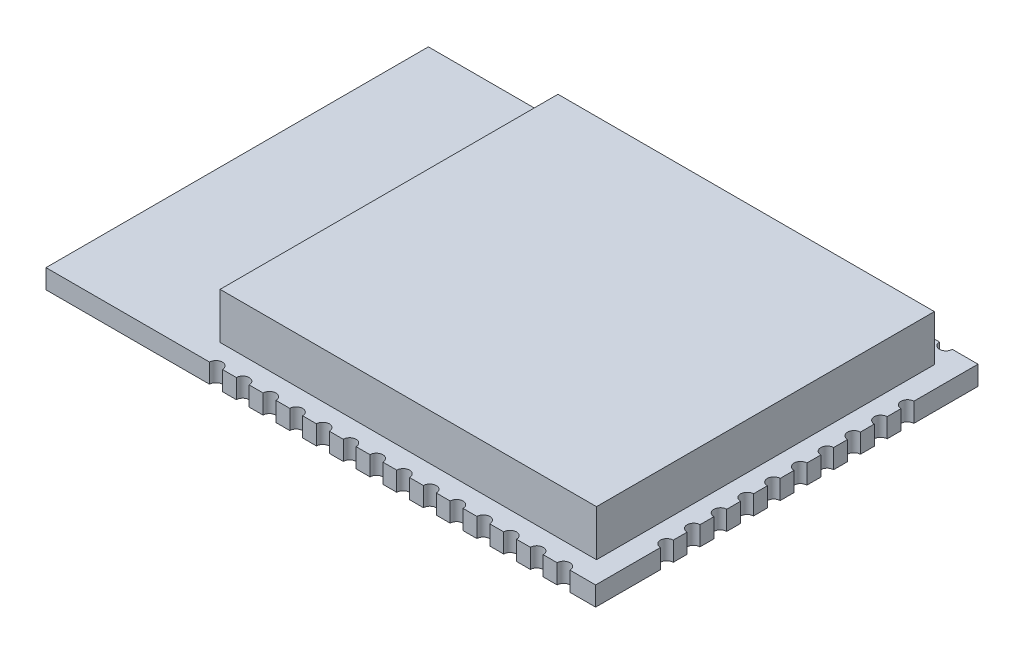
from build123d import *

# Parameters (mm, degrees)
SKETCH2_W             = 25.7
SKETCH2_H             = 17.88
BOSS_EXTRUDE1_DEPTH   = 0.9
SKETCH3_W             = 17.6
SKETCH3_H             = 15.8
BOSS_EXTRUDE2_DEPTH   = 2.15
F_1_5MM_DOWEL_HOLE1_D = 0.6


with BuildPart() as part:
    # Sketch2 → Boss-Extrude1 (new body)
    with BuildSketch(Plane(origin=(0, 0, 0), x_dir=(1, 0, 0), z_dir=(0, 1, 0))):
        Rectangle(SKETCH2_W, SKETCH2_H)
    extrude(amount=BOSS_EXTRUDE1_DEPTH)

    # Sketch3 → Boss-Extrude2 (add)
    with BuildSketch(Plane(origin=(0, 0.9, 0), x_dir=(1, 0, 0), z_dir=(0, 1, 0))):
        with Locations((3.05, 0)):
            Rectangle(SKETCH3_W, SKETCH3_H)
    extrude(amount=BOSS_EXTRUDE2_DEPTH)

    # Ø1.5mm Dowel Hole1 (through all)
    with Locations(Plane(origin=(0, 3.05, 0), x_dir=(1, 0, 0), z_dir=(0, 1, 0))):
        with Locations((11.35, 8.94), (10.1, 8.94), (8.85, 8.94), (7.6, 8.94), (6.35, 8.94), (5.1, 8.94), (3.85, 8.94), (2.6, 8.94), (1.35, 8.94), (0.1, 8.94), (-1.15, 8.94), (-2.4, 8.94), (-3.65, 8.94), (-4.9, 8.94), (11.35, -8.94), (10.1, -8.94), (8.85, -8.94), (7.6, -8.94), (6.35, -8.94), (5.1, -8.94), (3.85, -8.94), (2.6, -8.94), (1.35, -8.94), (0.1, -8.94), (-1.15, -8.94), (-2.4, -8.94), (-3.65, -8.94), (-4.9, -8.94), (12.85, 5.64), (12.85, 4.39), (12.85, 3.14), (12.85, 1.89), (12.85, 0.64), (12.85, -0.61), (12.85, -1.86), (12.85, -3.11), (12.85, -4.36), (12.85, -5.61)):
            Hole(F_1_5MM_DOWEL_HOLE1_D / 2)


solid = part.part
